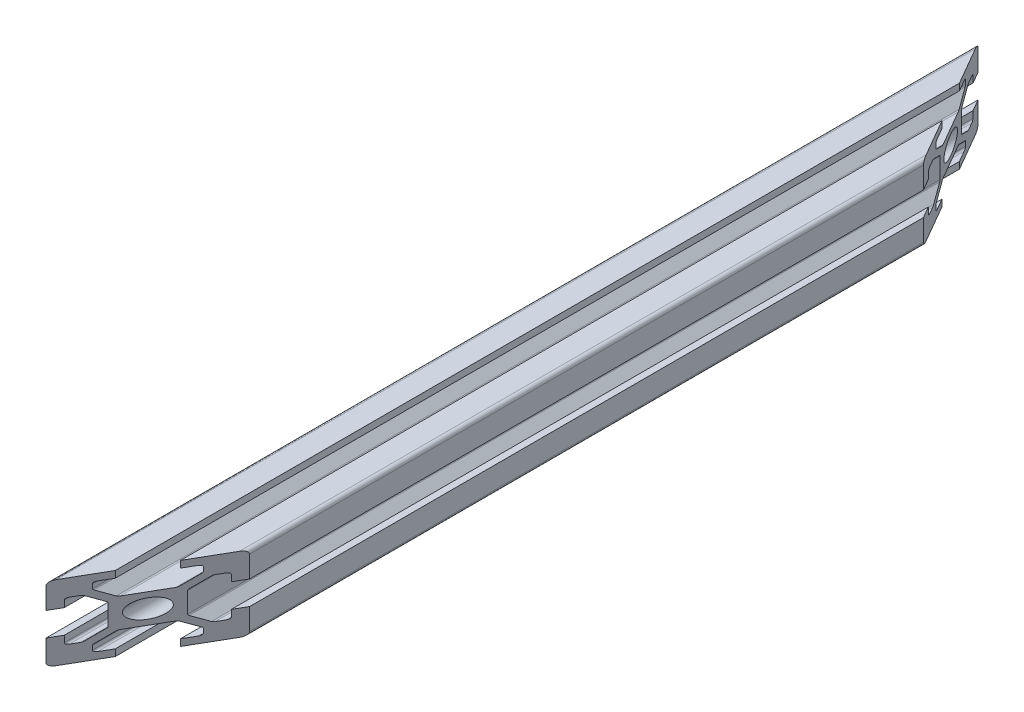
from build123d import *

# Parameters (mm, degrees)
SKETCH1_R           = 2.5
BOSS_EXTRUDE1_DEPTH = 250
FILLET1_R           = 1
FILLET2_R           = 0.5
FILLET3_R           = 0.5
FILLET4_R           = 0.5
FILLET5_R           = 0.5
CUT_EXTRUDE3_DEPTH  = 252.594912508
CUT_EXTRUDE5_DEPTH  = 252.594912508


with BuildPart() as part:
    # Sketch1 → Boss-Extrude1 (new body)
    with BuildSketch(Plane.XY):
        Polygon((13.2, 0), (13.2, 1.8), (15.45, 1.8), (15.45, 3.6), (12.95, 6.1), (7.05, 6.1), (4.55, 3.6), (4.55, 1.8), (6.8, 1.8), (6.8, 0), (0, 0), (0, 6.8), (1.8, 6.8), (1.8, 4.55), (3.6, 4.55), (6.1, 7.05), (6.1, 12.95), (3.6, 15.45), (1.8, 15.45), (1.8, 13.2), (0, 13.2), (0, 20), (6.8, 20), (6.8, 18.2), (4.55, 18.2), (4.55, 16.4), (7.05, 13.9), (12.95, 13.9), (15.45, 16.4), (15.45, 18.2), (13.2, 18.2), (13.2, 20), (20, 20), (20, 13.2), (18.2, 13.2), (18.2, 15.45), (16.4, 15.45), (13.9, 12.95), (13.9, 7.05), (16.4, 4.55), (18.2, 4.55), (18.2, 6.8), (20, 6.8), (20, 0), align=None)
        with Locations((10, 10)):
            Circle(SKETCH1_R, mode=Mode.SUBTRACT)
    extrude(amount=BOSS_EXTRUDE1_DEPTH)

    # Fillet1
    fillet1_edges = [part.edges().sort_by_distance(p)[0] for p in [
        (0, 0, 125),
        (0, 20, 125),
        (20, 20, 125),
        (20, 0, 125),
    ]]
    fillet(fillet1_edges, radius=FILLET1_R)

    # Fillet2
    fillet2_edges = [part.edges().sort_by_distance(p)[0] for p in [
        (4.55, 18.2, 125),
        (4.55, 16.4, 125),
        (7.05, 13.9, 125),
        (12.95, 13.9, 125),
        (15.45, 16.4, 125),
        (15.45, 18.2, 125),
    ]]
    fillet(fillet2_edges, radius=FILLET2_R)

    # Fillet3
    fillet3_edges = [part.edges().sort_by_distance(p)[0] for p in [
        (18.2, 15.45, 125),
        (16.4, 15.45, 125),
        (13.9, 12.95, 125),
        (13.9, 7.05, 125),
        (16.4, 4.55, 125),
        (18.2, 4.55, 125),
    ]]
    fillet(fillet3_edges, radius=FILLET3_R)

    # Fillet4
    fillet4_edges = [part.edges().sort_by_distance(p)[0] for p in [
        (1.8, 4.55, 125),
        (3.6, 4.55, 125),
        (6.1, 7.05, 125),
        (6.1, 12.95, 125),
        (3.6, 15.45, 125),
        (1.8, 15.45, 125),
    ]]
    fillet(fillet4_edges, radius=FILLET4_R)

    # Fillet5
    fillet5_edges = [part.edges().sort_by_distance(p)[0] for p in [
        (15.45, 1.8, 125),
        (15.45, 3.6, 125),
        (12.95, 6.1, 125),
        (7.05, 6.1, 125),
        (4.55, 3.6, 125),
        (4.55, 1.8, 125),
    ]]
    fillet(fillet5_edges, radius=FILLET5_R)

    # Sketch4 → Cut-Extrude3 (cut, through all)
    with BuildSketch(Plane.XZ):
        Polygon((20, 250), (20, 215.358983849), (0, 250), align=None)
    extrude(amount=-CUT_EXTRUDE3_DEPTH, mode=Mode.SUBTRACT)

    # Sketch6 → Cut-Extrude5 (cut, through all)
    with BuildSketch(Plane.XZ):
        Polygon((20, 0), (0, 0), (20, 34.641016151), align=None)
    extrude(amount=-CUT_EXTRUDE5_DEPTH, mode=Mode.SUBTRACT)


solid = part.part
